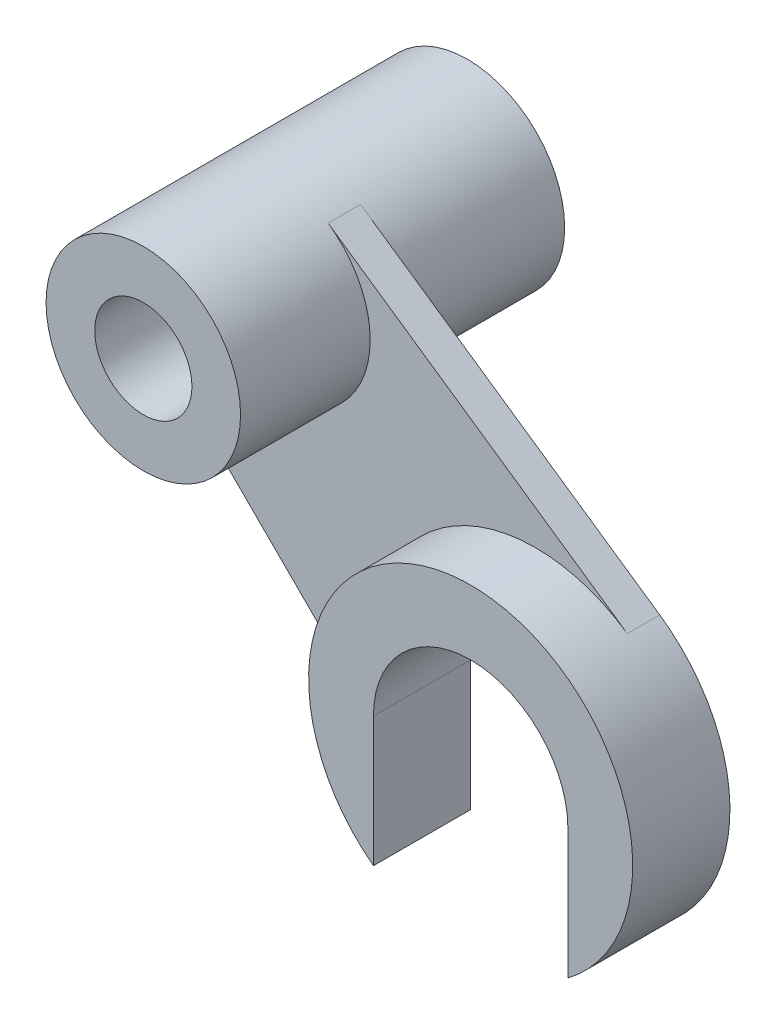
from build123d import *

# Parameters (mm, degrees)
SKETCH1_R             = 30
BOSS_EXTRUDE1_DEPTH   = 50
SKETCH2_R             = 50
BOSS_EXTRUDE2_DEPTH   = 30
BOSS_EXTRUDE3_DEPTH   = 10
F_1_5MM_DOWEL_HOLE1_D = 30
CUT_EXTRUDE1_DEPTH    = 202.15131476


with BuildPart() as part:
    # Sketch1 → Boss-Extrude1 (new, symmetric)
    with BuildSketch(Plane.XY):
        Circle(SKETCH1_R)
    extrude(amount=BOSS_EXTRUDE1_DEPTH, both=True)



with BuildPart() as body_2:
    # Sketch2 → Boss-Extrude2 (new body)
    with BuildSketch(Plane.XY):
        with Locations((81.003249692, -80)):
            Circle(SKETCH2_R)
    extrude(amount=BOSS_EXTRUDE2_DEPTH)


with BuildPart() as part_1:
    add(part.part)

    add(body_2.part)  # Boss-Extrude3 merges body 2
    # Sketch3 → Boss-Extrude3 (add)
    with BuildSketch(Plane.XY):
        Polygon((17.003072039, 24.716301124), (109.34170309, -38.806164794), (45.716447378, -115.423743202), (-30, -40), (-30, 0), align=None)
    extrude(amount=BOSS_EXTRUDE3_DEPTH)

    # Ø1.5mm Dowel Hole1 (through all)
    with Locations(Plane.XY.offset(50)):
        with Locations((0, 0)):
            Hole(F_1_5MM_DOWEL_HOLE1_D / 2)

    # Sketch6 → Cut-Extrude1 (cut, through all)
    with BuildSketch(Plane.XY.offset(30)):
        with BuildLine():
            Line((111.003249692, -80), (111.003249692, -166.852911506))
            ThreePointArc((111.003249692, -166.852911506), (81.003249692, -196.852911506), (51.003249692, -166.852911506))
            Line((51.003249692, -166.852911506), (51.003249692, -80))
            ThreePointArc((51.003249692, -80), (81.003249692, -50), (111.003249692, -80))
        make_face()
    extrude(amount=-CUT_EXTRUDE1_DEPTH, mode=Mode.SUBTRACT)


solid = part_1.part
